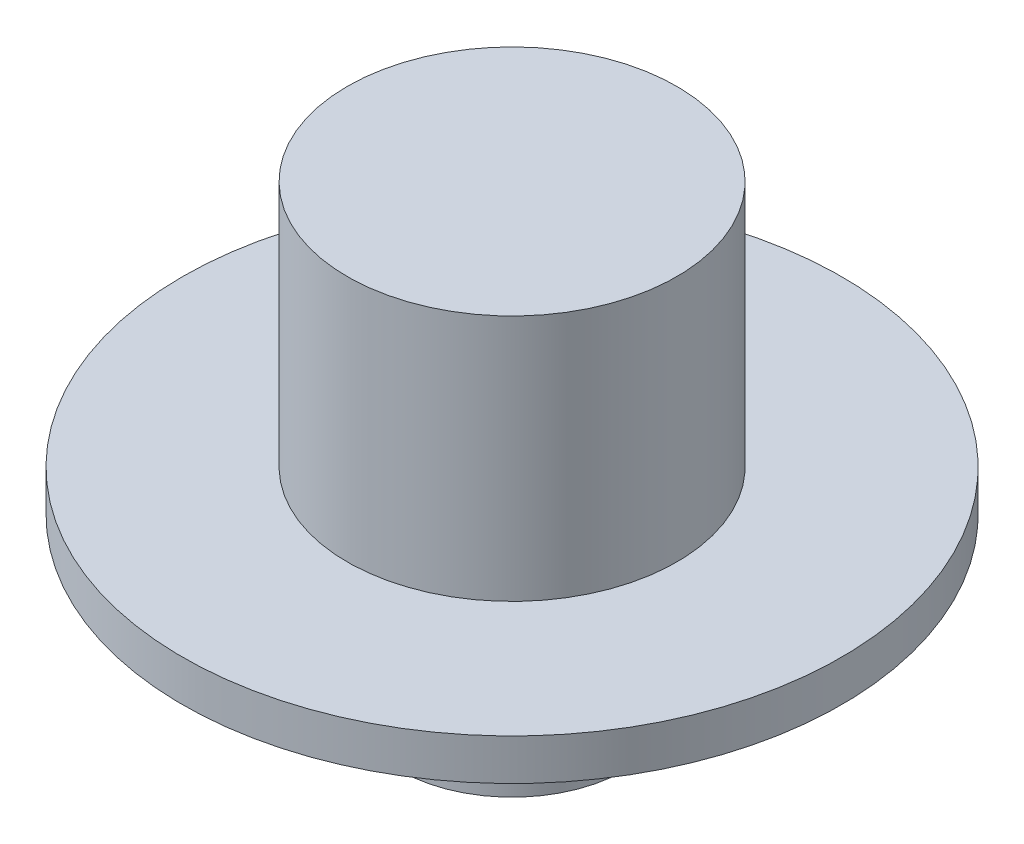
from build123d import *


with BuildPart() as part:
    # Sketch1 → Revolve1 (revolve)
    with BuildSketch(Plane.XY, mode=Mode.PRIVATE) as revolve1_sk:
        Polygon((0, 0), (1.375, 0), (1.375, 2), (4, 2), (4, 2.5), (2, 2.5), (2, 5.5), (0, 5.5), align=None)
    revolve(revolve1_sk.sketch.rotate(Axis((0, 5.5, 0), (0, -1, 0)), 180), axis=Axis((0, 5.5, 0), (0, -1, 0)))


solid = part.part
